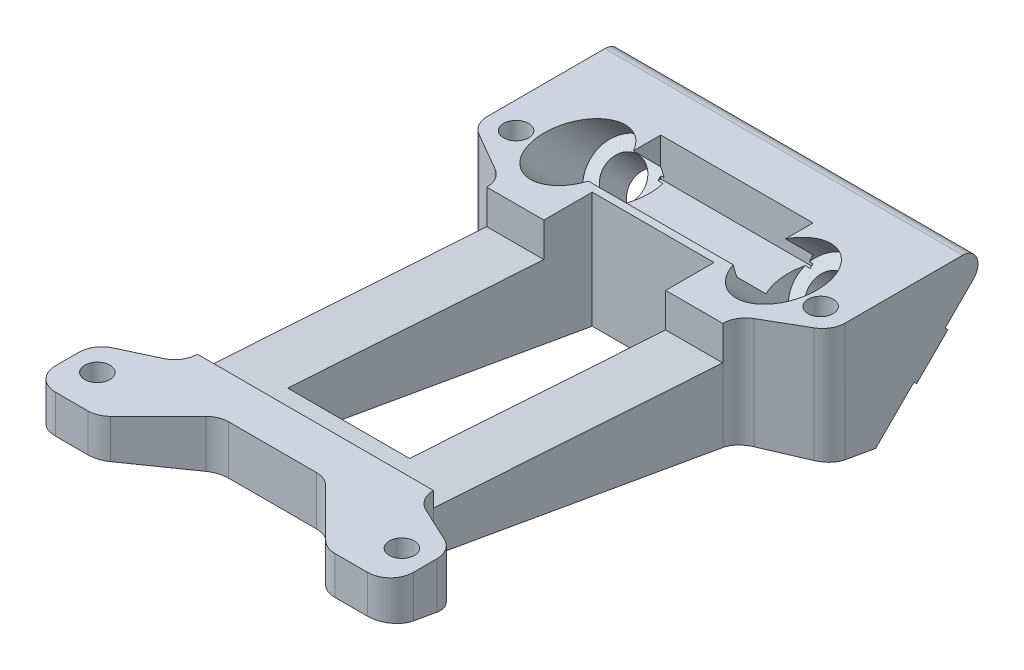
from build123d import *

# Parameters (mm, degrees)
EXTRUDE_2_DEPTH      = 5
EXTRUDE_3_DEPTH      = 23.5
SKETCH_3_R           = 1.65
CUT_EXTRUDE_1_DEPTH  = 85.951456727
CUT_EXTRUDE_5_REACH  = 89.951
CUT_EXTRUDE_START    = 3
SKETCH_8_R           = 3
CUT_EXTRUDE_10_REACH = 89.951
CUT_EXTRUDE_START_2  = -3
SKETCH_12_R          = 3
SKETCH_4_W           = 20
SKETCH_4_H           = 10
CUT_EXTRUDE_2_DEPTH  = 5
SKETCH_10_W          = 16
SKETCH_10_H          = 40
CUT_EXTRUDE_11_DEPTH = 85.951456727
FILLET_1_R           = 3
CUT_EXTRUDE_6_DEPTH  = 94.465851734
SKETCH_6_R           = 2.6
CUT_EXTRUDE_3_DEPTH  = 83.421182124
CUT_EXTRUDE_4_REACH  = 89.421
CUT_EXTRUDE_START_3  = -5
SKETCH_7_R           = 4.4
FILLET_3_R           = 2
CUT_EXTRUDE_13_DEPTH = 90.709896


with BuildPart() as part:
    # 草图2 → 凸台-拉伸2 (new body)
    with BuildSketch(Plane(origin=(0, 0, 0), x_dir=(1, 0, 0), z_dir=(0, 1, 0))):
        Polygon((0, 0), (23.5, 0), (23.5, -19), (23.5, -80), (0, -80), align=None)
    extrude_2 = extrude(amount=EXTRUDE_2_DEPTH)

    # 镜向1: 凸台-拉伸2 across plane
    add(extrude_2.mirror(Plane(origin=(0, 5, 80), x_dir=(0, 0, 1), z_dir=(1, 0, 0))))

    # 草图5 → 凸台-拉伸3 (add, symmetric)
    with BuildSketch(Plane(origin=(0, 0, 0), x_dir=(0, 0, -1), z_dir=(1, 0, 0))):
        Polygon((-80, 0), (-16.263455967, -11.263455967), (-11.242997821, -6.242997821), (-9.192388155, -4.192388155), (-13.384776311, 0), align=None)
        Polygon((-13.384776311, 0), (-9.192388155, -4.192388155), (-7.14177849, -2.14177849), (-5, 0), align=None)
        Polygon((-7.14177849, -2.14177849), (-9.192388155, -4.192388155), (-8.838834765, -4.545941546), (-6.788225099, -2.495331881), align=None)
        Polygon((-9.192388155, -4.192388155), (-11.242997821, -6.242997821), (-10.88944443, -6.596551211), (-8.838834765, -4.545941546), align=None)
    extrude(amount=EXTRUDE_3_DEPTH, both=True)

    # 草图3 → 切除-拉伸1 (cut, through all)
    with BuildSketch(Plane(origin=(0, 5, 0), x_dir=(1, 0, 0), z_dir=(0, 1, 0))):
        with Locations(Location((-20, -20, 0), (0, 0, 270))):
            Circle(SKETCH_3_R)
        with Locations(Location((20, -20, 0), (0, 0, 270))):
            Circle(SKETCH_3_R)
        with Locations(Location((-20, -75, 0), (0, 0, 270))):
            Circle(SKETCH_3_R)
        with Locations(Location((20, -75, 0), (0, 0, 270))):
            Circle(SKETCH_3_R)
    extrude(amount=-CUT_EXTRUDE_1_DEPTH, mode=Mode.SUBTRACT)

    # 切除-拉伸5: up to this plane
    cut_extrude_5_end = Plane(origin=(23.5, -13.709378738, 2.422707194), z_dir=(0, 0.9847416717466503, -0.174022527063632))
    # 草图8 → 切除-拉伸5 (cut, up to the surface)
    with BuildSketch(Plane.XZ.offset(-5).offset(CUT_EXTRUDE_START), mode=Mode.PRIVATE) as cut_extrude_5_sk1:
        with Locations(Location((-20, 20, 0), (0, 0, 90))):
            Circle(SKETCH_8_R)
    cut_extrude_5_tool1 = split(extrude(cut_extrude_5_sk1.sketch, amount=CUT_EXTRUDE_5_REACH, mode=Mode.PRIVATE), bisect_by=cut_extrude_5_end, keep=Keep.BOTH, mode=Mode.PRIVATE)
    add(cut_extrude_5_tool1.solids().sort_by_distance((-20, 2, 20))[0], mode=Mode.SUBTRACT)
    # 草图8 → 切除-拉伸5 (cut, up to the surface)
    with BuildSketch(Plane.XZ.offset(-5).offset(CUT_EXTRUDE_START), mode=Mode.PRIVATE) as cut_extrude_5_sk2:
        with Locations(Location((20, 20, 0), (0, 0, 90))):
            Circle(SKETCH_8_R)
    cut_extrude_5_tool2 = split(extrude(cut_extrude_5_sk2.sketch, amount=CUT_EXTRUDE_5_REACH, mode=Mode.PRIVATE), bisect_by=cut_extrude_5_end, keep=Keep.BOTH, mode=Mode.PRIVATE)
    add(cut_extrude_5_tool2.solids().sort_by_distance((20, 2, 20))[0], mode=Mode.SUBTRACT)

    # 切除-拉伸10: up to this plane
    cut_extrude_10_end = Plane(origin=(23.5, -13.709378738, 2.422707194), z_dir=(0, 0.9847416717466503, -0.174022527063632))
    # 草图12 → 切除-拉伸10 (cut, up to the surface)
    with BuildSketch(Plane(origin=(0, 5, 0), x_dir=(1, 0, 0), z_dir=(0, 1, 0)).offset(CUT_EXTRUDE_START_2), mode=Mode.PRIVATE) as cut_extrude_10_sk1:
        with Locations(Location((-20, -75, 0), (0, 0, 270))):
            Circle(SKETCH_12_R)
    cut_extrude_10_tool1 = split(extrude(cut_extrude_10_sk1.sketch, amount=-CUT_EXTRUDE_10_REACH, mode=Mode.PRIVATE), bisect_by=cut_extrude_10_end, keep=Keep.BOTH, mode=Mode.PRIVATE)
    add(cut_extrude_10_tool1.solids().sort_by_distance((-20, 2, 75))[0], mode=Mode.SUBTRACT)
    # 草图12 → 切除-拉伸10 (cut, up to the surface)
    with BuildSketch(Plane(origin=(0, 5, 0), x_dir=(1, 0, 0), z_dir=(0, 1, 0)).offset(CUT_EXTRUDE_START_2), mode=Mode.PRIVATE) as cut_extrude_10_sk2:
        with Locations(Location((20, -75, 0), (0, 0, 270))):
            Circle(SKETCH_12_R)
    cut_extrude_10_tool2 = split(extrude(cut_extrude_10_sk2.sketch, amount=-CUT_EXTRUDE_10_REACH, mode=Mode.PRIVATE), bisect_by=cut_extrude_10_end, keep=Keep.BOTH, mode=Mode.PRIVATE)
    add(cut_extrude_10_tool2.solids().sort_by_distance((20, 2, 75))[0], mode=Mode.SUBTRACT)

    # 草图4 → 切除-拉伸2 (cut)
    with BuildSketch(Plane(origin=(0, 5, 0), x_dir=(1, 0, 0), z_dir=(0, 1, 0))):
        with Locations((0, -16)):
            Rectangle(SKETCH_4_W, SKETCH_4_H)
    extrude(amount=-CUT_EXTRUDE_2_DEPTH, mode=Mode.SUBTRACT)

    # 草图10 → 切除-拉伸11 (cut, through all)
    with BuildSketch(Plane(origin=(0, 5, 0), x_dir=(1, 0, 0), z_dir=(0, 1, 0))):
        with Locations((0, -42)):
            Rectangle(SKETCH_10_W, SKETCH_10_H)
        Polygon((-7, -72), (-15, -80), (15, -80), (7, -72), align=None)
        Polygon((23.5, -22), (15.5, -26.618802154), (15.5, -68.269538735), (23.5, -72), align=None)
        Polygon((-15.5, -26.618802154), (-23.5, -22), (-23.5, -72), (-15.5, -68.269538735), align=None)
    extrude(amount=-CUT_EXTRUDE_11_DEPTH, mode=Mode.SUBTRACT)

    # 圆角1
    fillet_1_edges = [part.edges().sort_by_distance(p)[0] for p in [
        (-23.5, -2.624849927, 22),
        (-23.5, 1.793124148, 72),
        (23.5, 1.793124148, 72),
        (23.5, -2.624849927, 22),
        (15, 2.5, 80),
        (-15, 2.5, 80),
        (-15.5, -2.216734964, 26.618802154),
        (-15.5, 1.463502525, 68.269538735),
        (15.5, 1.463502525, 68.269538735),
        (15.5, -2.216734964, 26.618802154),
        (-7, 1.793124148, 72),
        (7, 1.793124148, 72),
        (-23.5, 2.5, 80),
        (23.5, 2.5, 80),
    ]]
    fillet(fillet_1_edges, radius=FILLET_1_R)

    # 草图9 → 切除-拉伸6 (cut, through all)
    with BuildSketch(Plane(origin=(23.5, 0, 0), x_dir=(0, 0, -1), z_dir=(1, 0, 0))):
        Polygon((-5, 0), (0, 5), (0, 0), align=None)
    extrude(amount=-CUT_EXTRUDE_6_DEPTH, mode=Mode.SUBTRACT)

    # 草图6 → 切除-拉伸3 (cut, through all)
    with BuildSketch(Plane(origin=(0, 2.146446609, 2.146446609), x_dir=(1, 0, 0), z_dir=(0, -0.7071067811865459, -0.7071067811865491))):
        with Locations(Location((-13.5, 9.464466094, 0), (0, 0, 270))):
            Circle(SKETCH_6_R)
        with Locations(Location((13.5, 9.464466094, 0), (0, 0, 270))):
            Circle(SKETCH_6_R)
    extrude(amount=-CUT_EXTRUDE_3_DEPTH, mode=Mode.SUBTRACT)

    # 草图7 → 切除-拉伸4 (cut, up to next)
    with BuildSketch(Plane(origin=(0, 2.146446609, 2.146446609), x_dir=(1, 0, 0), z_dir=(0, -0.7071067811865459, -0.7071067811865491)).offset(CUT_EXTRUDE_START_3), mode=Mode.PRIVATE) as cut_extrude_4_sk1:
        with Locations((-13.5, 9.464466094)):
            Circle(SKETCH_7_R)
    cut_extrude_4_tool1 = extrude(cut_extrude_4_sk1.sketch, amount=-CUT_EXTRUDE_4_REACH, mode=Mode.PRIVATE) & part.part
    # 草图7 → 切除-拉伸4 (cut, up to next)
    with BuildSketch(Plane(origin=(0, 2.146446609, 2.146446609), x_dir=(1, 0, 0), z_dir=(0, -0.7071067811865459, -0.7071067811865491)).offset(CUT_EXTRUDE_START_3), mode=Mode.PRIVATE) as cut_extrude_4_sk2:
        with Locations((13.5, 9.464466094)):
            Circle(SKETCH_7_R)
    cut_extrude_4_tool2 = extrude(cut_extrude_4_sk2.sketch, amount=-CUT_EXTRUDE_4_REACH, mode=Mode.PRIVATE) & part.part
    add(cut_extrude_4_tool1.solids().sort_by_distance((-13.5, -1.010408, 12.374369))[0], mode=Mode.SUBTRACT)
    add(cut_extrude_4_tool2.solids().sort_by_distance((13.5, -1.010408, 12.374369))[0], mode=Mode.SUBTRACT)

    # 圆角3
    fillet_3_edges = [part.edges().sort_by_distance(p)[0] for p in [
        (0, 5, 0),
    ]]
    fillet(fillet_3_edges, radius=FILLET_3_R)

    # 草图14 → 切除-拉伸13 (cut, through all)
    with BuildSketch(Plane.ZY.offset(15.5)):
        Polygon((28.350852961, 5), (28.350852961, 0.5), (66.358327952, 3), (66.358327952, 5), align=None)
    extrude(amount=-CUT_EXTRUDE_13_DEPTH, mode=Mode.SUBTRACT)


solid = part.part
